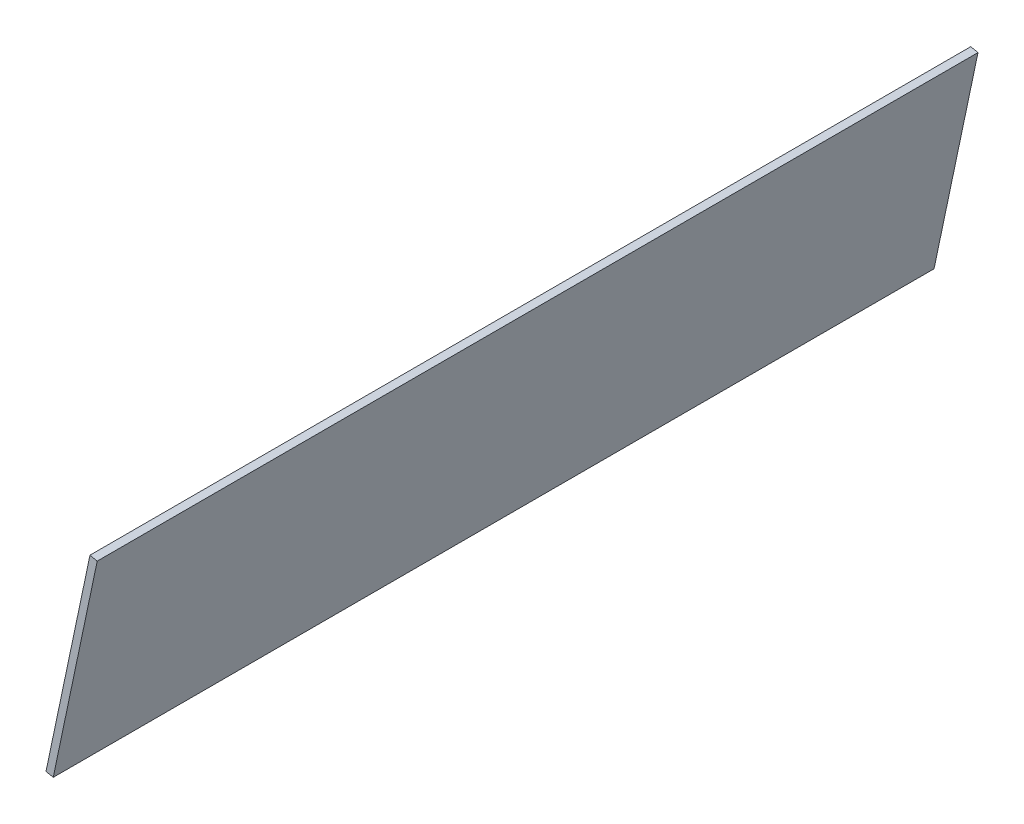
from build123d import *

# Parameters (mm, degrees)
BOSS_EXTRUDE1_DEPTH = 393.4


with BuildPart() as part:
    # Sketch1 → Boss-Extrude1 (new body)
    with BuildSketch(Plane.XY):
        Polygon((24.224008988, -184.530911805), (43.864109101, -91.066006839), (47.093578952, -91.744626382), (27.453478839, -185.209531349), align=None)
    extrude(amount=BOSS_EXTRUDE1_DEPTH)


solid = part.part
